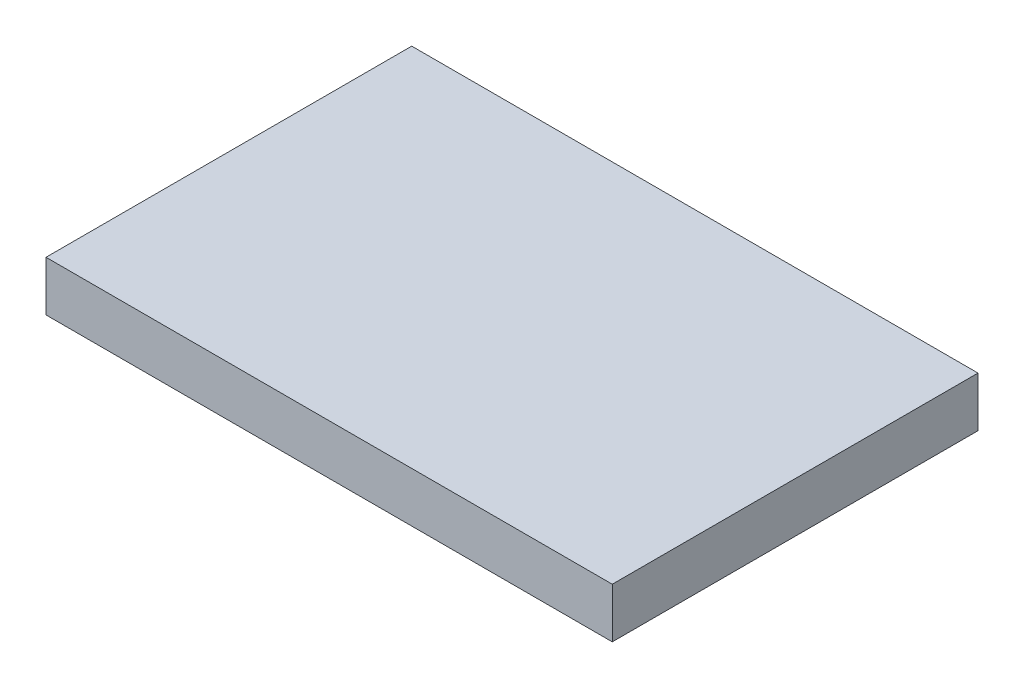
from build123d import *

# Parameters (mm, degrees)
SKETCH1_W           = 72
SKETCH1_H           = 46.5
BOSS_EXTRUDE1_DEPTH = 6.35


with BuildPart() as part:
    # Sketch1 → Boss-Extrude1 (new body)
    with BuildSketch(Plane(origin=(0, 0, 0), x_dir=(1, 0, 0), z_dir=(0, 1, 0))):
        with Locations((36, 23.25)):
            Rectangle(SKETCH1_W, SKETCH1_H)
    extrude(amount=BOSS_EXTRUDE1_DEPTH)


solid = part.part
